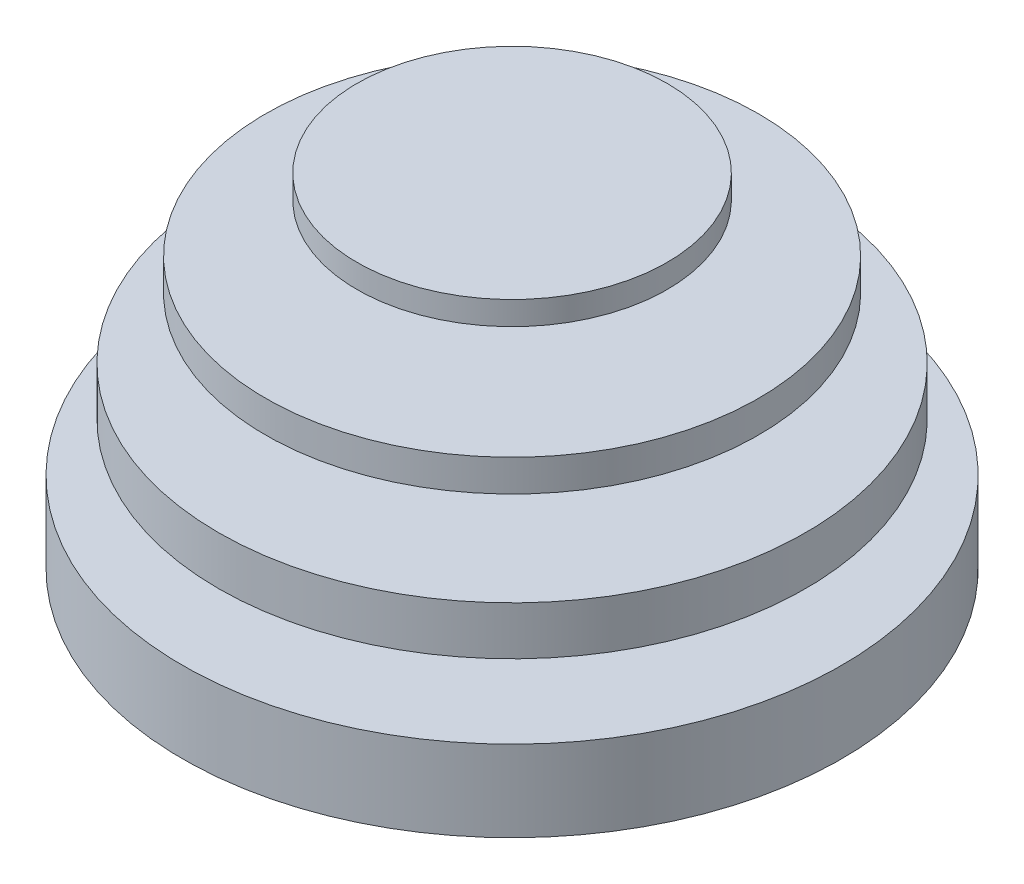
from build123d import *

# Parameters (mm, degrees)
SKETCH1_W   = 64.498680347
SKETCH1_H   = 15.853667228
SKETCH1_W_2 = 57.452606024
SKETCH1_H_2 = 9.485100051
SKETCH1_W_3 = 48.238508831
SKETCH1_H_3 = 6.233065748
SKETCH1_W_4 = 30.352320163
SKETCH1_H_4 = 4.607048596


with BuildPart() as part:
    # Sketch1 → Revolve1 (revolve)
    with BuildSketch(Plane.XY, mode=Mode.PRIVATE) as revolve1_sk:
        with Locations((32.249340174, 7.926833614)):
            Rectangle(SKETCH1_W, SKETCH1_H)
        with Locations((28.726303012, 30.081317305)):
            Rectangle(SKETCH1_W_2, SKETCH1_H_2)
        with Locations((24.119254416, 49.864525983)):
            Rectangle(SKETCH1_W_3, SKETCH1_H_3)
        with Locations((15.176160082, 64.769683206)):
            Rectangle(SKETCH1_W_4, SKETCH1_H_4)
    revolve(revolve1_sk.sketch.rotate(Axis((0, 25.338767279, 0), (0, 1, 0)), 90), axis=Axis((0, 25.338767279, 0), (0, 1, 0)))


solid = part.part
